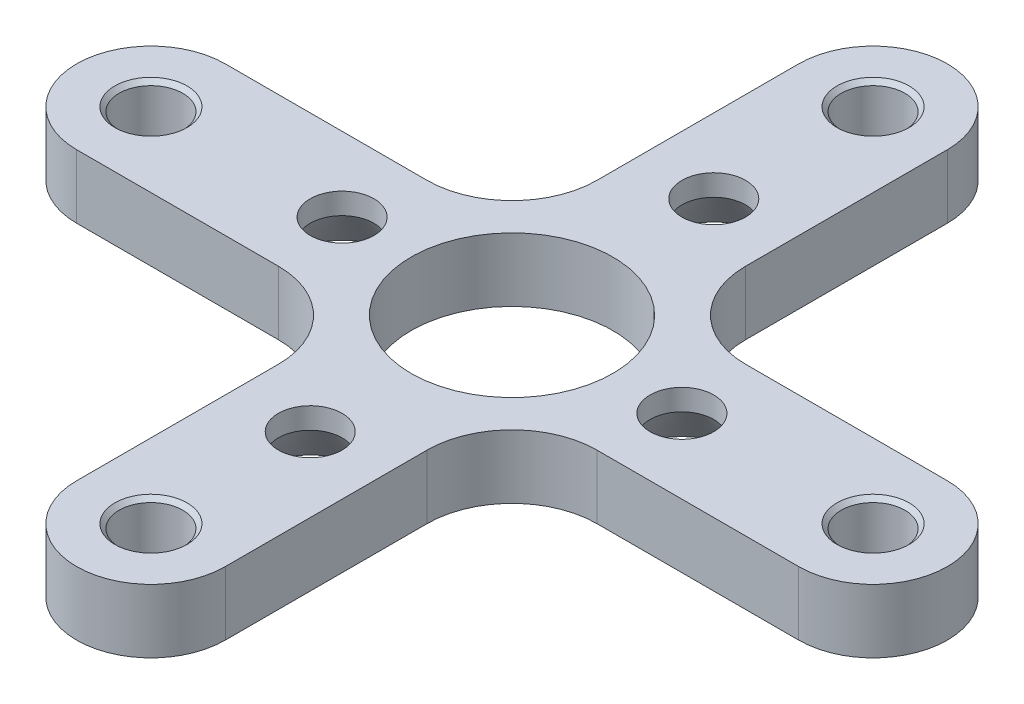
from build123d import *
from OCP.BRepFilletAPI import BRepFilletAPI_MakeChamfer

# Parameters (mm, degrees)
SKETCH1_R           = 1.5
SKETCH1_R_2         = 4.75
BOSS_EXTRUDE1_DEPTH = 3
CHAMFER1_SIZE       = 0.2
CHAMFER2_SIZE       = 2
CHAMFER2_SIZE2      = 1.400415076


with BuildPart() as part:
    # Sketch1 → Boss-Extrude1 (new body)
    with BuildSketch(Plane(origin=(0, 0, 0), x_dir=(1, 0, 0), z_dir=(0, 1, 0))):
        with BuildLine():
            Line((-3.5, 7.5), (-3.5, 17))
            ThreePointArc((-3.5, 17), (0, 20.5), (3.5, 17))
            Line((3.5, 17), (3.5, 7.5))
            ThreePointArc((3.5, 7.5), (4.671572875, 4.671572875), (7.5, 3.5))
            Line((7.5, 3.5), (17, 3.5))
            ThreePointArc((17, 3.5), (20.5, 0), (17, -3.5))
            Line((17, -3.5), (7.5, -3.5))
            ThreePointArc((7.5, -3.5), (4.671572875, -4.671572875), (3.5, -7.5))
            Line((3.5, -7.5), (3.5, -17))
            ThreePointArc((3.5, -17), (0, -20.5), (-3.5, -17))
            Line((-3.5, -17), (-3.5, -7.5))
            ThreePointArc((-3.5, -7.5), (-4.671572875, -4.671572875), (-7.5, -3.5))
            Line((-7.5, -3.5), (-17, -3.5))
            ThreePointArc((-17, -3.5), (-20.5, 0), (-17, 3.5))
            Line((-17, 3.5), (-7.5, 3.5))
            ThreePointArc((-7.5, 3.5), (-4.671572875, 4.671572875), (-3.5, 7.5))
        make_face()
        with Locations(Location((0, 17, 0), (0, 0, 270))):
            Circle(SKETCH1_R, mode=Mode.SUBTRACT)
        with Locations(Location((0, 0, 0), (0, 0, 270))):
            Circle(SKETCH1_R_2, mode=Mode.SUBTRACT)
        with Locations(Location((17, 0, 0), (0, 0, 270))):
            Circle(SKETCH1_R, mode=Mode.SUBTRACT)
        with Locations(Location((0, -17, 0), (0, 0, 270))):
            Circle(SKETCH1_R, mode=Mode.SUBTRACT)
        with Locations(Location((-17, 0, 0), (0, 0, 270))):
            Circle(SKETCH1_R, mode=Mode.SUBTRACT)
        with Locations(Location((0, 9.5, 0), (0, 0, 270))):
            Circle(SKETCH1_R, mode=Mode.SUBTRACT)
        with Locations(Location((8, 0, 0), (0, 0, 270))):
            Circle(SKETCH1_R, mode=Mode.SUBTRACT)
        with Locations(Location((-8, 0, 0), (0, 0, 90))):
            Circle(SKETCH1_R, mode=Mode.SUBTRACT)
        with Locations(Location((0, -9.5, 0), (0, 0, 90))):
            Circle(SKETCH1_R, mode=Mode.SUBTRACT)
    extrude(amount=BOSS_EXTRUDE1_DEPTH)

    # Chamfer1
    chamfer1_edges = [part.edges().sort_by_distance(p)[0] for p in [
        (0, 0, -18.5),
        (0, 3, -18.5),
        (17, 0, -1.5),
        (17, 3, -1.5),
        (0, 0, 15.5),
        (0, 3, 15.5),
        (-17, 0, -1.5),
        (-17, 3, -1.5),
    ]]
    chamfer(chamfer1_edges, length=CHAMFER1_SIZE)

    # Chamfer2: one chamfer whose edges measure the first distance from different faces: ONE call of the kernel's chamfer builder (chamfer() names one face for all edges)
    chamfer2_edges_1 = [part.edges().sort_by_distance(p)[0] for p in [
        (0, 0, -11),
    ]]
    chamfer2_side_1 = [part.faces().sort_by_distance(p)[0] for p in [
        (0, 1.5, -11),
    ]]
    chamfer2_edges_2 = [part.edges().sort_by_distance(p)[0] for p in [
        (8, 0, -1.5),
    ]]
    chamfer2_side_2 = [part.faces().sort_by_distance(p)[0] for p in [
        (8, 1.5, -1.5),
    ]]
    chamfer2_edges_3 = [part.edges().sort_by_distance(p)[0] for p in [
        (-8, 0, 1.5),
    ]]
    chamfer2_side_3 = [part.faces().sort_by_distance(p)[0] for p in [
        (-8, 1.5, 1.5),
    ]]
    chamfer2_edges_4 = [part.edges().sort_by_distance(p)[0] for p in [
        (0, 0, 11),
    ]]
    chamfer2_side_4 = [part.faces().sort_by_distance(p)[0] for p in [
        (0, 1.5, 11),
    ]]
    chamfer2 = BRepFilletAPI_MakeChamfer(part.part.solid().wrapped)
    for e in chamfer2_edges_1:
        chamfer2.Add(CHAMFER2_SIZE, CHAMFER2_SIZE2, e.wrapped, chamfer2_side_1[0].wrapped)  # the first distance lies on this face
    for e in chamfer2_edges_2:
        chamfer2.Add(CHAMFER2_SIZE, CHAMFER2_SIZE2, e.wrapped, chamfer2_side_2[0].wrapped)  # the first distance lies on this face
    for e in chamfer2_edges_3:
        chamfer2.Add(CHAMFER2_SIZE, CHAMFER2_SIZE2, e.wrapped, chamfer2_side_3[0].wrapped)  # the first distance lies on this face
    for e in chamfer2_edges_4:
        chamfer2.Add(CHAMFER2_SIZE, CHAMFER2_SIZE2, e.wrapped, chamfer2_side_4[0].wrapped)  # the first distance lies on this face
    add(Compound.cast(chamfer2.Shape()), mode=Mode.REPLACE)


solid = part.part
